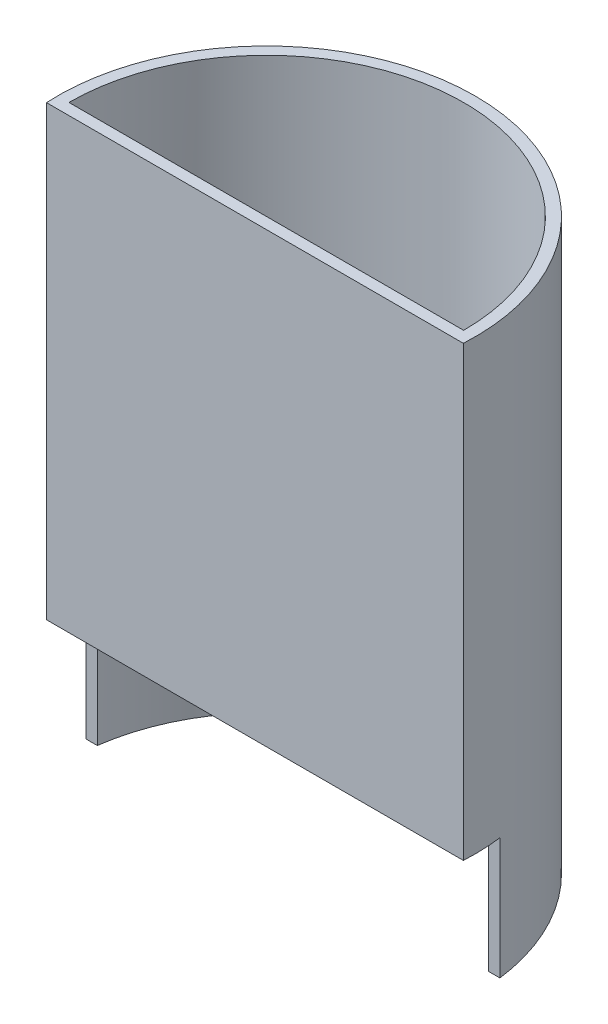
from build123d import *

# Parameters (mm, degrees)
BOSS_EXTRUDE1_DEPTH = 150
SKETCH3_W           = 109.836241742
SKETCH3_H           = 14
CUT_EXTRUDE3_DEPTH  = 5
CUT_EXTRUDE4_DEPTH  = 10
BOSS_EXTRUDE2_DEPTH = 15
DRAFT2_ANGLE        = 60


with BuildPart() as part:
    # Sketch1 → Boss-Extrude1 (new body)
    with BuildSketch(Plane(origin=(0, 0, 0), x_dir=(1, 0, 0), z_dir=(0, 1, 0))):
        with BuildLine():
            Line((-54.918120871, -3), (54.918120871, -3))
            ThreePointArc((54.918120871, -3), (0, 55), (-54.918120871, -3))
        make_face()
        with BuildLine():
            Line((-52, 0), (52, 0))
            ThreePointArc((52, 0), (0, 52), (-52, 0))
        make_face(mode=Mode.SUBTRACT)
    extrude(amount=BOSS_EXTRUDE1_DEPTH)

    # Sketch3 → Cut-Extrude3 (cut)
    with BuildSketch(Plane.XY.offset(3)):
        with Locations((0, 25)):
            Rectangle(SKETCH3_W, SKETCH3_H)
    extrude(amount=-CUT_EXTRUDE3_DEPTH, mode=Mode.SUBTRACT)

    # Sketch4 → Cut-Extrude4 (cut)
    with BuildSketch(Plane.XY.offset(3)):
        Polygon((0, 0), (62.110162625, 0), (62.110162625, 32), (-64.723211538, 32), (-64.723211538, 0), align=None)
    extrude(amount=-CUT_EXTRUDE4_DEPTH, mode=Mode.SUBTRACT)

    # Sketch6 → Boss-Extrude2 (add)
    with BuildSketch(Plane(origin=(0, 32, 0), x_dir=(-1, 0, 0), z_dir=(0, -1, 0))):
        with BuildLine():
            Line((27.712812921, 44), (0, 0))
            Line((0, 0), (52, 0))
            ThreePointArc((52, 0), (45.525082492, 25.129004438), (27.712812921, 44))
        make_face()
    extrude(amount=-BOSS_EXTRUDE2_DEPTH)

    # Draft2
    draft2_faces = [part.faces().sort_by_distance(p)[0] for p in [
        (-29.079569776, 47, -16.051385257),
    ]]
    draft(draft2_faces, Plane(origin=(-27.712812921, 47, -44), x_dir=(0.5329387100211931, 0, 0.8461538461538461), z_dir=(0.8461538461538461, 0, -0.5329387100211931)), DRAFT2_ANGLE)


solid = part.part
